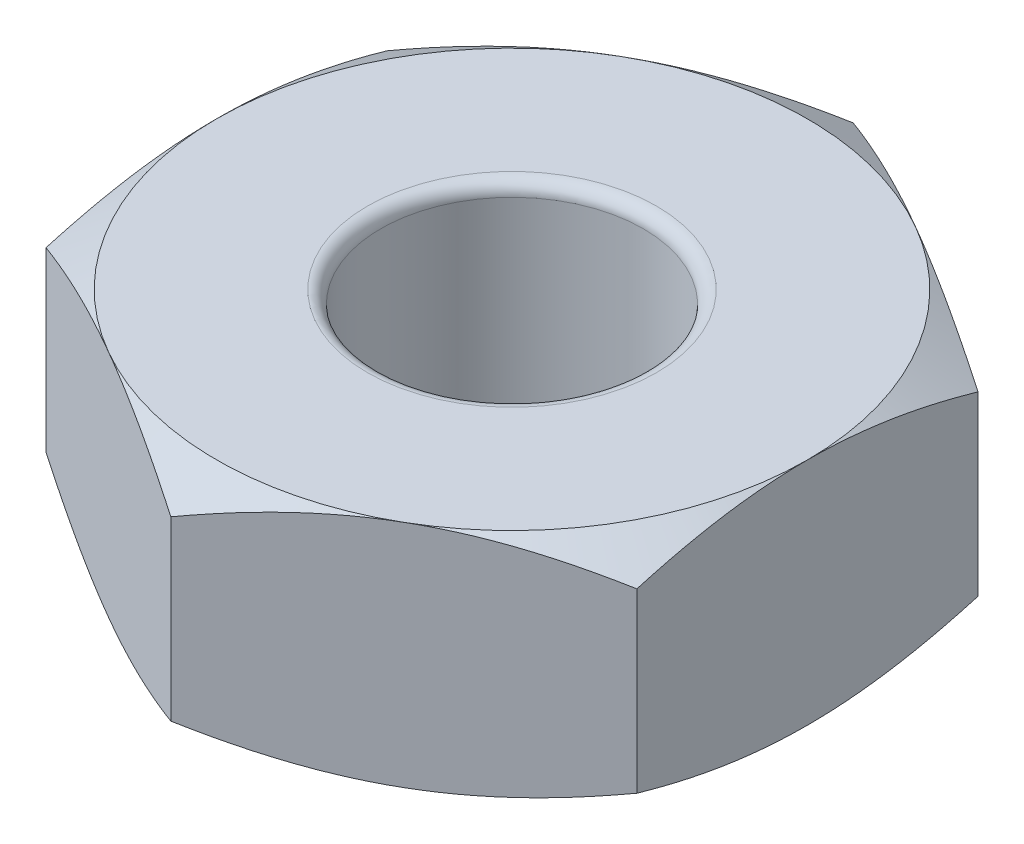
from build123d import *

# Parameters (mm, degrees)
SKETCH1_R           = 1
BOSS_EXTRUDE1_DEPTH = 1.75
SKETCH2_OUTSIDE_W   = 13.98
SKETCH2_OUTSIDE_H   = 14.676
SKETCH2_OUTSIDE_R   = 2.25
CUT_EXTRUDE1_DEPTH  = 1.75
CUT_EXTRUDE1_DRAFT  = -60
SKETCH3_OUTSIDE_W   = 13.98
SKETCH3_OUTSIDE_H   = 14.676
SKETCH3_OUTSIDE_R   = 2.25
CUT_EXTRUDE2_DEPTH  = 1.75
CUT_EXTRUDE2_DRAFT  = -60
FILLET1_R           = 0.1


with BuildPart() as part:
    # Sketch1 → Boss-Extrude1 (new body)
    with BuildSketch(Plane(origin=(0, 0, 0), x_dir=(1, 0, 0), z_dir=(0, 1, 0))):
        Polygon((0, -2.598076211), (2.25, -1.299038106), (2.25, 1.299038106), (0, 2.598076211), (-2.25, 1.299038106), (-2.25, -1.299038106), align=None)
        with Locations(Location((0, 0, 0), (0, 0, 270))):
            Circle(SKETCH1_R, mode=Mode.SUBTRACT)
    extrude(amount=BOSS_EXTRUDE1_DEPTH)


with BuildPart() as cut_extrude1_tool:
    # Sketch2 outside → Cut-Extrude1 (with draft: the straight prism first)
    with BuildSketch(Plane(origin=(0, 1.75, 0), x_dir=(1, 0, 0), z_dir=(0, 1, 0))):
        Rectangle(SKETCH2_OUTSIDE_W, SKETCH2_OUTSIDE_H)
        Circle(SKETCH2_OUTSIDE_R, mode=Mode.SUBTRACT)
    extrude(amount=-CUT_EXTRUDE1_DEPTH)
    # Cut-Extrude1: the draft: its side faces are tilted about the plane it starts from
    cut_extrude1_sides = [cut_extrude1_tool.faces().sort_by_distance(p)[0] for p in [
        (0, 0.875, 7.338),
        (6.99, 0.875, 0),
        (0, 0.875, -7.338),
        (-6.99, 0.875, 0),
        (-2.25, 0.875, 0),
    ]]
    draft(cut_extrude1_sides, Plane(origin=(0, 1.75, 0), x_dir=(1, 0, 0), z_dir=(0, 1, 0)), CUT_EXTRUDE1_DRAFT)


with BuildPart() as part_1:
    add(part.part)

    # Cut-Extrude1: cut by cut_extrude1_tool
    add(cut_extrude1_tool.part, mode=Mode.SUBTRACT)


with BuildPart() as cut_extrude2_tool:
    # Sketch3 outside → Cut-Extrude2 (with draft: the straight prism first)
    with BuildSketch(Plane.XZ):
        Rectangle(SKETCH3_OUTSIDE_W, SKETCH3_OUTSIDE_H)
        Circle(SKETCH3_OUTSIDE_R, mode=Mode.SUBTRACT)
    extrude(amount=-CUT_EXTRUDE2_DEPTH)
    # Cut-Extrude2: the draft: its side faces are tilted about the plane it starts from
    cut_extrude2_sides = [cut_extrude2_tool.faces().sort_by_distance(p)[0] for p in [
        (0, 0.875, -7.338),
        (6.99, 0.875, 0),
        (0, 0.875, 7.338),
        (-6.99, 0.875, 0),
        (-2.25, 0.875, 0),
    ]]
    draft(cut_extrude2_sides, Plane.XZ, CUT_EXTRUDE2_DRAFT)


with BuildPart() as part_2:
    add(part_1.part)

    # Cut-Extrude2: cut by cut_extrude2_tool
    add(cut_extrude2_tool.part, mode=Mode.SUBTRACT)

    # Fillet1
    fillet1_edges = [part_2.edges().sort_by_distance(p)[0] for p in [
        (0, 0, -1),
        (0, 1.75, -1),
    ]]
    fillet(fillet1_edges, radius=FILLET1_R)


solid = part_2.part
